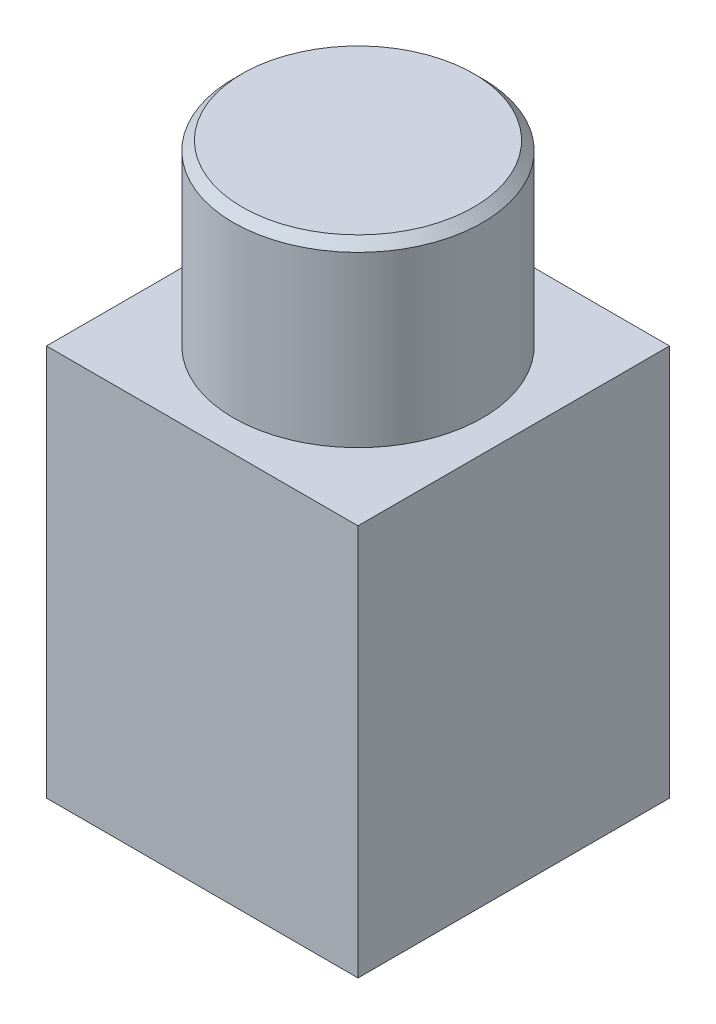
from build123d import *

# Parameters (mm, degrees)
SKETCH_1_W          = 3
SKETCH_1_H          = 3
EXTRUDE_1_DEPTH     = 4.4
SKETCH_2_R          = 1.4
EXTRUDE_2_DEPTH     = 2
SKETCH_3_R          = 1.1
CUT_EXTRUDE_1_DEPTH = 0.2
CHAMFER_1_SIZE      = 0.1
SKETCH_4_W          = 3.5
SKETCH_4_H          = 3.5
SKETCH_4_W_2        = 3
SKETCH_4_H_2        = 3
EXTRUDE_3_DEPTH     = 4.4


with BuildPart() as part:
    # 草图1 → 凸台-拉伸1 (new body)
    with BuildSketch(Plane(origin=(0, 0, 0), x_dir=(1, 0, 0), z_dir=(0, 1, 0))):
        Rectangle(SKETCH_1_W, SKETCH_1_H)
    extrude(amount=EXTRUDE_1_DEPTH)

    # 草图2 → 凸台-拉伸2 (add)
    with BuildSketch(Plane(origin=(0, 4.4, 0), x_dir=(1, 0, 0), z_dir=(0, 1, 0))):
        with Locations(Location((0, 0, 0), (0, 0, 90))):
            Circle(SKETCH_2_R)
    extrude(amount=EXTRUDE_2_DEPTH)

    # 草图3 → 切除-拉伸1 (cut)
    with BuildSketch(Plane.XZ):
        with Locations(Location((0, 0, 0), (0, 0, 270))):
            Circle(SKETCH_3_R)
    extrude(amount=-CUT_EXTRUDE_1_DEPTH, mode=Mode.SUBTRACT)

    # 倒角1
    chamfer_1_edges = [part.edges().sort_by_distance(p)[0] for p in [
        (0, 6.4, 1.4),
    ]]
    chamfer(chamfer_1_edges, length=CHAMFER_1_SIZE)

    # 草图4 → 凸台-拉伸3 (add)
    with BuildSketch(Plane.XZ):
        Rectangle(SKETCH_4_W, SKETCH_4_H)
        Rectangle(SKETCH_4_W_2, SKETCH_4_H_2, mode=Mode.SUBTRACT)
    extrude(amount=-EXTRUDE_3_DEPTH)


solid = part.part
